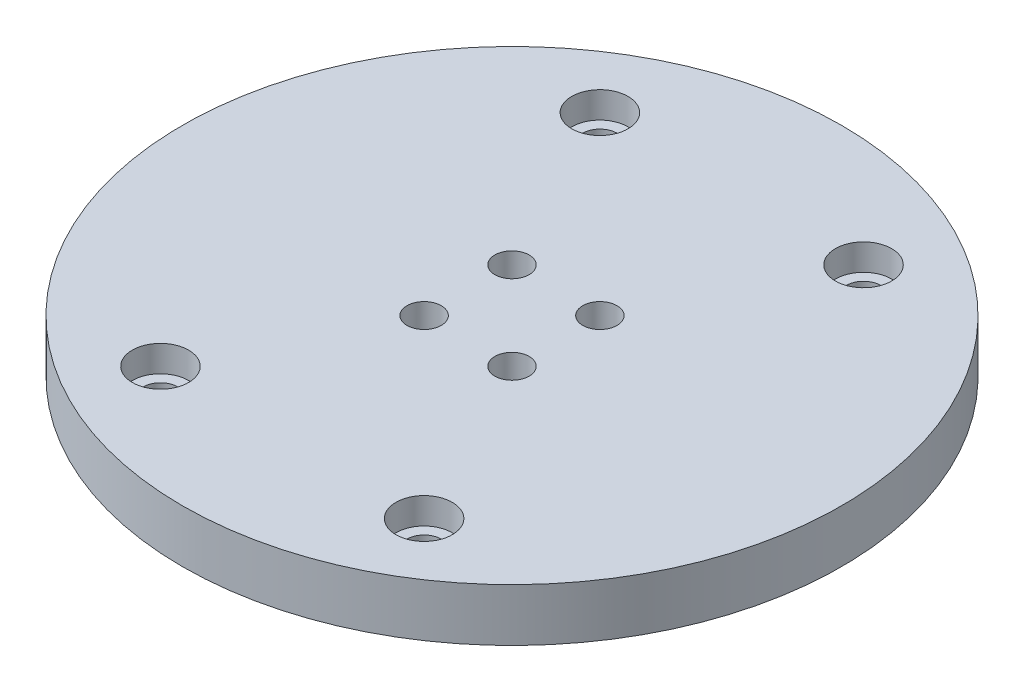
from build123d import *

# Parameters (mm, degrees)
SKIZZE1_R                       = 37.5
AUFSATZ_LINEAR_AUSTRAGEN1_DEPTH = 6
BOHRUNG3_D                      = 3.9
BOHRUNG3_CBORE_D                = 6.3
BOHRUNG3_CBORE_DEPTH            = 3
BOHRUNG4_D                      = 3.9
BOHRUNG4_CBORE_D                = 6.4
BOHRUNG4_CBORE_DEPTH            = 3


with BuildPart() as part:
    # Skizze1 → Aufsatz-Linear austragen1 (new body)
    with BuildSketch(Plane(origin=(0, 0, 0), x_dir=(1, 0, 0), z_dir=(0, 1, 0))):
        with Locations(Location((25, 30, 0), (0, 0, 270))):
            Circle(SKIZZE1_R)
    extrude(amount=AUFSATZ_LINEAR_AUSTRAGEN1_DEPTH)

    # Bohrung3 (through all)
    with Locations(Plane(origin=(20, 0, -25), x_dir=(0, 0, -1), z_dir=(0, -1, 0))):
        with Locations((0, 0), (0, 10), (10, 10), (10, 0)):
            CounterBoreHole(BOHRUNG3_D / 2, BOHRUNG3_CBORE_D / 2, BOHRUNG3_CBORE_DEPTH)

    # Bohrung4 (through all)
    with Locations(Plane(origin=(10, 6, -55), x_dir=(0, 0, 1), z_dir=(0, 1, 0))):
        with Locations((0, 0), (50, 30), (50, 0), (0, 30)):
            CounterBoreHole(BOHRUNG4_D / 2, BOHRUNG4_CBORE_D / 2, BOHRUNG4_CBORE_DEPTH)


solid = part.part
